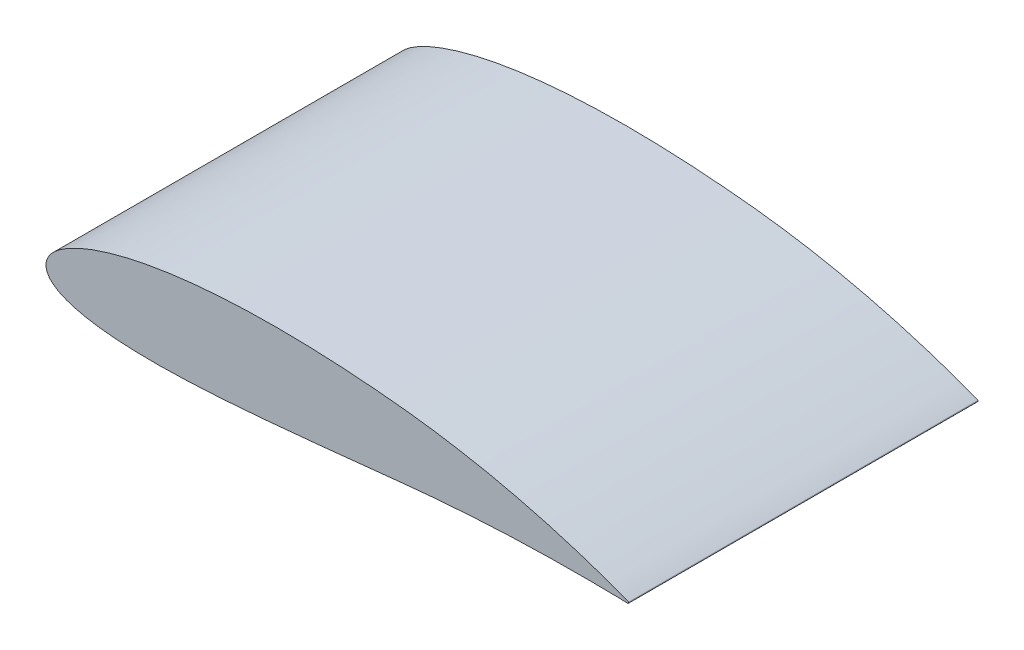
from build123d import *

# Parameters (mm, degrees)
BOSS_EXTRUDE3_DEPTH = 90


with BuildPart() as part:
    # Sketch7 → Boss-Extrude3 (new body)
    with BuildSketch(Plane.XY):
        with BuildLine():
            add(Edge.make_bspline(
                [(179.588060426, 1.517477898), (179.576980625, 1.523316302), (179.527180976, 1.538576696), (179.421970927, 1.582605512), (179.24229771, 1.649509967), (178.992812633, 1.745282853), (178.671668193, 1.867097555), (178.279838927, 2.015212449), (177.817399271, 2.189137144), (177.284549147, 2.387848871), (176.681798516, 2.611028764), (176.009453986, 2.857474368), (175.268117898, 3.126428987), (174.458335755, 3.4172099), (173.580535126, 3.728287363), (172.635439233, 4.058854742), (171.623700852, 4.407629891), (170.546119436, 4.773459219), (169.403384347, 5.154713784), (168.196526464, 5.550383467), (166.926382858, 5.958885437), (165.593875433, 6.378563234), (164.200263192, 6.808587035), (162.746450214, 7.246832236), (161.233690439, 7.691860647), (159.663252029, 8.142362943), (158.036335519, 8.596441833), (156.354321049, 9.052781613), (154.618636874, 9.509564823), (152.830851068, 9.965600156), (150.992405701, 10.418668689), (149.104962138, 10.867603783), (147.17020668, 11.310816586), (145.189797123, 11.746567066), (143.165573432, 12.173481817), (141.099421487, 12.590000181), (138.993246948, 12.994650133), (136.849050518, 13.385943925), (134.668800492, 13.762290498), (132.454661508, 14.12267356), (130.208668679, 14.465402247), (127.933119429, 14.789426543), (125.630188223, 15.093342949), (123.302221968, 15.37588288), (120.956559744, 15.635628767), (118.60313396, 15.870611723), (116.246049137, 16.093601694), (113.882670193, 16.299995693), (111.508426938, 16.490833046), (109.125817651, 16.665453765), (106.737190283, 16.822429837), (104.345107652, 16.961986616), (101.951919344, 17.082770129), (99.560203056, 17.184639421), (97.172394196, 17.266800274), (94.791052363, 17.329044687), (92.41861156, 17.370265088), (90.05763516, 17.390658663), (87.710613599, 17.389644335), (85.379999978, 17.366681532), (83.068288671, 17.321823289), (80.777986957, 17.254537311), (78.51152788, 17.165102303), (76.271331627, 17.052924045), (74.059778076, 16.918394223), (71.879269236, 16.761419491), (69.732168694, 16.581943317), (67.620701642, 16.380396735), (65.547227383, 16.156872884), (63.51392254, 15.9115303), (61.522967242, 15.645305308), (59.57641662, 15.358182024), (57.676461534, 15.05075724), (55.825024517, 14.723775809), (54.02412913, 14.377788442), (52.275597212, 14.013629851), (50.581234091, 13.631994061), (48.942805558, 13.233611238), (47.361961344, 12.819508242), (45.840444084, 12.390342515), (44.379568795, 11.947628077), (42.981001719, 11.491770647), (41.645987184, 11.023913815), (40.375848792, 10.545332843), (39.171753442, 10.056923486), (38.034975382, 9.559546012), (36.966374649, 9.054579658), (35.967057938, 8.542689209), (35.037808955, 8.02515137), (34.179499468, 7.502836642), (33.392877227, 6.976619819), (32.678534082, 6.447410092), (32.036647894, 5.91636428), (31.468463133, 5.383465479), (30.973603754, 4.850137159), (30.553146836, 4.31627708), (30.206897697, 3.782658915), (29.935409528, 3.249545274), (29.739560538, 2.717122143), (29.619216188, 2.186104488), (29.575623227, 1.656856547), (29.608168179, 1.132657339), (29.715137627, 0.618483615), (29.896529864, 0.119481834), (30.151643679, -0.361168539), (30.479212092, -0.82342063), (30.878303949, -1.267215712), (31.348448745, -1.69240627), (31.888590564, -2.099304663), (32.498313752, -2.487616884), (33.17661877, -2.85782391), (33.923004688, -3.209475103), (34.736641874, -3.542408441), (35.616630498, -3.856618097), (36.562049747, -4.151877108), (37.571981705, -4.427876832), (38.645262707, -4.684802196), (39.780929269, -4.922107003), (40.977723256, -5.13997795), (42.234438163, -5.33823315), (43.549815388, -5.516586681), (44.922461212, -5.675396639), (46.351123784, -5.814402467), (47.834366983, -5.933456866), (49.370753302, -6.033239847), (50.958791309, -6.113121215), (52.596943896, -6.173965168), (54.283686439, -6.215654526), (56.017464924, -6.238689414), (57.796636814, -6.242964632), (59.619600084, -6.229305705), (61.4846135, -6.198130742), (63.390074071, -6.149623408), (65.334131713, -6.084411959), (67.315107888, -6.003463804), (69.331173306, -5.90668323), (71.380560785, -5.795357967), (73.461405089, -5.669851589), (75.571805817, -5.530927948), (77.709900993, -5.379768367), (79.873770819, -5.216242662), (82.06151402, -5.042321282), (84.271128977, -4.857641104), (86.500625032, -4.664193184), (88.747946824, -4.461678661), (91.011145978, -4.251966435), (93.288093141, -4.035112956), (95.576760813, -3.812614647), (97.87499311, -3.584717162), (100.180778938, -3.352550219), (102.491898128, -3.116739786), (104.806278064, -2.878285167), (107.121648106, -2.637715079), (109.435963712, -2.395767133), (111.74694331, -2.15329857), (114.052473461, -1.910815071), (116.350299628, -1.668806885), (118.631279435, -1.42940365), (120.888261412, -1.189688562), (123.120857447, -0.962674285), (125.334387089, -0.747794129), (127.531724289, -0.545258837), (129.710702538, -0.354545548), (131.869222752, -0.176250999), (134.005127016, -0.010320095), (136.116189313, 0.143710317), (138.200341607, 0.285611307), (140.255410231, 0.415882612), (142.279312568, 0.534518234), (144.269889544, 0.641927065), (146.225004175, 0.738250297), (148.142585789, 0.824324976), (150.020552167, 0.90024727), (151.856949609, 0.9665257), (153.649624253, 1.023789819), (155.396678904, 1.072507516), (157.096119717, 1.112958526), (158.746086421, 1.146164026), (160.344639462, 1.172261005), (161.889970008, 1.192362611), (163.380287605, 1.206383923), (164.813886622, 1.215320874), (166.189019378, 1.219736106), (167.504086566, 1.219998626), (168.757537892, 1.216748886), (169.947874366, 1.210620768), (171.073646467, 1.202037497), (172.133502858, 1.191375534), (173.126146201, 1.179361291), (174.050324531, 1.166309257), (174.90489386, 1.152906438), (175.688791521, 1.138850105), (176.401135509, 1.125465708), (177.040911672, 1.112269884), (177.607372593, 1.099952643), (178.099735569, 1.088759918), (178.517397535, 1.078928038), (178.85994933, 1.070249051), (179.126577336, 1.064484669), (179.317862464, 1.057743636), (179.431695843, 1.057944096), (179.643196103, 1.038687547), (179.724309794, 1.445682494), (179.588060426, 1.517477898)],
                knots=[0, 0, 0, 0, 0.000123822, 0.000494213, 0.001111173, 0.001974009, 0.003081819, 0.004433467, 0.006027084, 0.007861827, 0.009935671, 0.012245642, 0.014790022, 0.017565576, 0.020570124, 0.023800302, 0.027252612, 0.030924034, 0.034810353, 0.038907699, 0.043211926, 0.047718933, 0.052424027, 0.057322441, 0.062409744, 0.067680161, 0.073129225, 0.078751723, 0.084541903, 0.090493722, 0.096602362, 0.102860959, 0.109264112, 0.115805905, 0.122479647, 0.12927918, 0.136197938, 0.14322942, 0.150366721, 0.15760364, 0.164932929, 0.172348035, 0.179841442, 0.187406728, 0.195036152, 0.202674121, 0.21028926, 0.217942829, 0.22562679, 0.23333414, 0.241056357, 0.248786566, 0.256516839, 0.264239851, 0.27194732, 0.27963247, 0.28728709, 0.294904021, 0.302475637, 0.309994363, 0.317453628, 0.32484546, 0.332162383, 0.339398454, 0.346546259, 0.353598448, 0.360549172, 0.367391584, 0.374119406, 0.380725883, 0.387206105, 0.393552926, 0.399762069, 0.405826762, 0.411742268, 0.417503811, 0.423106201, 0.428545262, 0.433816777, 0.438916146, 0.443839519, 0.448584629, 0.453146932, 0.457524919, 0.461715437, 0.465717104, 0.469528434, 0.473148685, 0.476578206, 0.47981703, 0.48286698, 0.485731568, 0.488414701, 0.490922623, 0.49326292, 0.49544722, 0.497489229, 0.499407626, 0.501223415, 0.502963898, 0.50465946, 0.506343712, 0.508027887, 0.509723264, 0.511463408, 0.513276831, 0.515191104, 0.517226444, 0.519400396, 0.521726284, 0.524214152, 0.526871935, 0.529704858, 0.53271637, 0.535909608, 0.539285246, 0.542843924, 0.546585429, 0.550508805, 0.554612107, 0.55889355, 0.563350718, 0.567980355, 0.572780515, 0.577746741, 0.582875767, 0.588163824, 0.593606484, 0.599199716, 0.604939386, 0.610819835, 0.616837244, 0.622985799, 0.629261052, 0.635656534, 0.64216771, 0.648788939, 0.655513613, 0.662336497, 0.669251318, 0.676251383, 0.683331719, 0.690484612, 0.697704055, 0.704983258, 0.712315678, 0.719694447, 0.727112545, 0.734563078, 0.742039048, 0.749533977, 0.757039405, 0.76454937, 0.772055934, 0.779552598, 0.787030988, 0.794485133, 0.801907187, 0.80922085, 0.816444387, 0.823619004, 0.830737499, 0.837793815, 0.844781287, 0.851692369, 0.858521026, 0.86526018, 0.871903295, 0.878443793, 0.884875116, 0.891190212, 0.897382542, 0.903446474, 0.909374451, 0.915161331, 0.920799526, 0.926283849, 0.931608156, 0.936766264, 0.94175199, 0.946560573, 0.9511858, 0.95562241, 0.959865126, 0.963909149, 0.967749665, 0.971381856, 0.974801378, 0.978004361, 0.980986446, 0.983743756, 0.98627339, 0.988571926, 0.990636951, 0.992464572, 0.994053802, 0.99540173, 0.996506884, 0.997368286, 0.997984001, 0.998354018, 0.998477345, 1, 1, 1, 1], degree=3))
        make_face()
    extrude(amount=BOSS_EXTRUDE3_DEPTH)


solid = part.part
